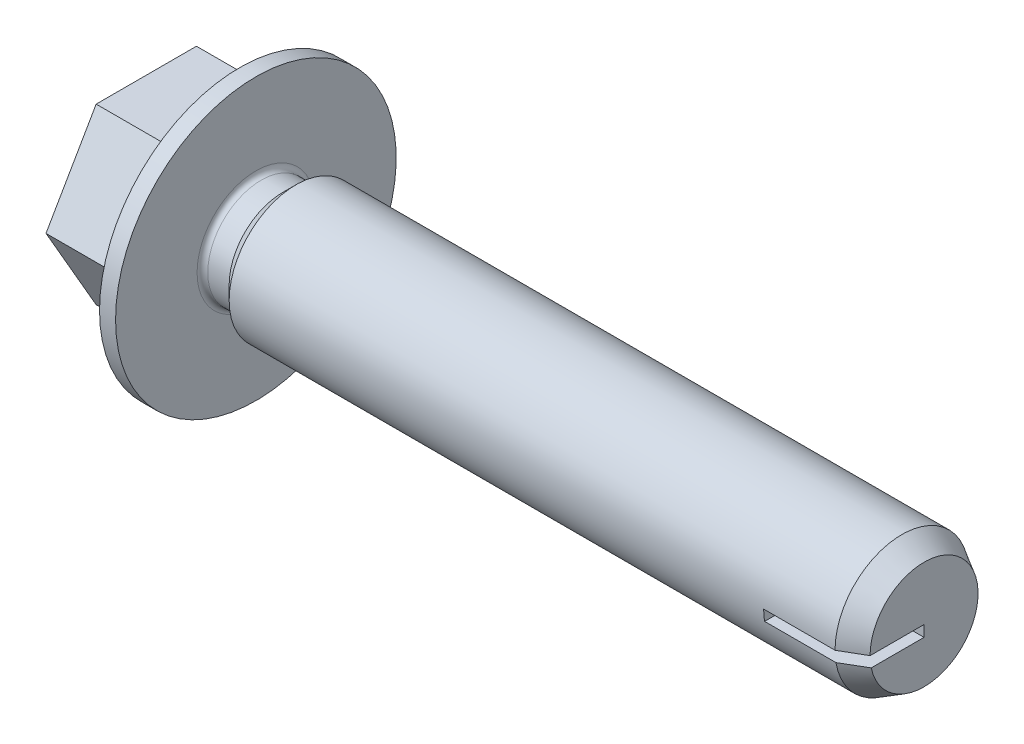
from build123d import *

# Parameters (mm, degrees)
EXTRUDE1_REACH           = 62.064
SKETCH11_W               = 7
SKETCH11_H               = 0.833333333
POINT_CUT_EXTRUDE8_DEPTH = 53.158412553


with BuildPart() as part:
    # Sketch1 → base-Revolve (revolve)
    with BuildSketch(Plane.XY, mode=Mode.PRIVATE) as base_revolve_sk:
        with BuildLine():
            Line((0, 10.5), (-1.2, 10.5))
            Line((-1.2, 10.5), (-2.499678785, 6.5))
            Line((-2.499678785, 6.5), (-8.2, 6.5))
            Line((-8.2, 6.5), (-8.2, 0))
            Line((-8.2, 0), (-6.8, 0))
            Line((-6.8, 0), (0, 0))
            Line((0, 0), (50, 0))
            Line((50, 0), (50, 5))
            Line((50, 5), (3, 5))
            Line((3, 5), (2, 4))
            Line((2, 4), (0.4, 4))
            ThreePointArc((0.4, 4), (0.117157288, 4.117157288), (0, 4.4))
            Line((0, 4.4), (0, 10.5))
        make_face()
    revolve(base_revolve_sk.sketch.rotate(Axis((0, 0, 0), (1, 0, 0)), 90), axis=Axis((0, 0, 0), (1, 0, 0)))

    # Extrude1: up to this cone (the profile starts outside it)
    extrude1_end = Plane(origin=(-8.2, 0, 0), z_dir=(1, 0, 0)).offset(3.58834419) * Cone(3.078e-06, 181.50840806, 58.97565581, align=(Align.CENTER, Align.CENTER, Align.MIN), mode=Mode.PRIVATE)
    # Sketch15 → Extrude1 (add, up to the surface)
    with BuildSketch(Plane.ZY.offset(8.2), mode=Mode.PRIVATE) as extrude1_sk1:
        Polygon((-3.75277675, 6.5), (-7.505553499, 0), (-3.75277675, -6.5), (3.75277675, -6.5), (7.505553499, 0), (3.75277675, 6.5), align=None)
    extrude1_tool1 = extrude(extrude1_sk1.sketch, amount=-EXTRUDE1_REACH, mode=Mode.PRIVATE) - extrude1_end
    add(extrude1_tool1.solids().sort_by_distance((-8.2, 0, 0))[0])

    # Sketch8 → point_Cut-Revolve1 (revolve, cut)
    with BuildSketch(Plane.XY, mode=Mode.PRIVATE) as point_cut_revolve1_sk:
        Polygon((50, 0), (50.508, 0), (50.508, 5.508), (48.337231225, 5.508), (48.337231225, 5), (50, 4.04), align=None)
    revolve(point_cut_revolve1_sk.sketch.rotate(Axis((0, 0, 0), (1, 0, 0)), 90), axis=Axis((0, 0, 0), (1, 0, 0)), mode=Mode.SUBTRACT)

    # Sketch11 → point_Cut-Extrude8 (cut, through all)
    with BuildSketch(Plane.XY):
        with Locations((46.5, -0.416666667)):
            Rectangle(SKETCH11_W, SKETCH11_H)
    extrude(amount=POINT_CUT_EXTRUDE8_DEPTH, mode=Mode.SUBTRACT)


solid = part.part
